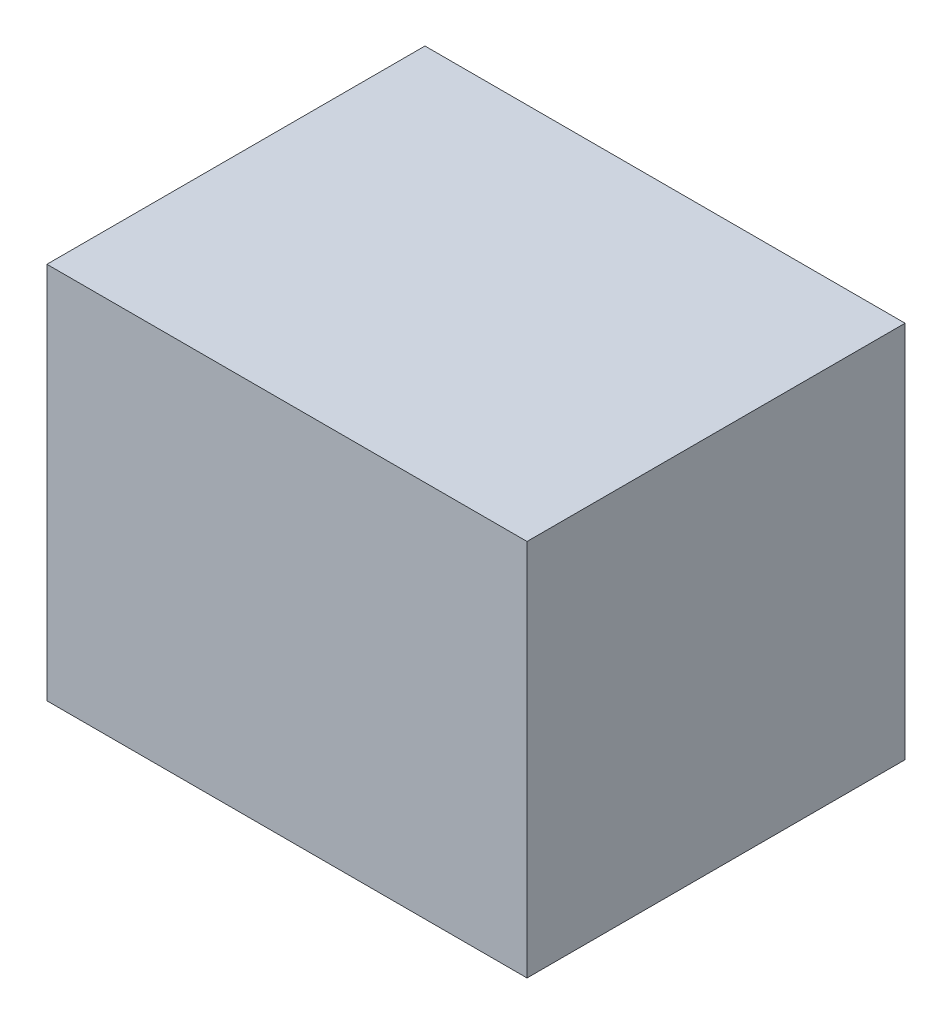
from build123d import *

# Parameters (mm, degrees)
SKETCH1_W           = 20
SKETCH1_H           = 20
BOSS_EXTRUDE1_DEPTH = 12.7


with BuildPart() as part:
    # Sketch1 → Boss-Extrude1 (new, symmetric)
    with BuildSketch(Plane(origin=(0, 0, 0), x_dir=(0, 0, -1), z_dir=(1, 0, 0))):
        Rectangle(SKETCH1_W, SKETCH1_H)
    extrude(amount=BOSS_EXTRUDE1_DEPTH, both=True)


solid = part.part
